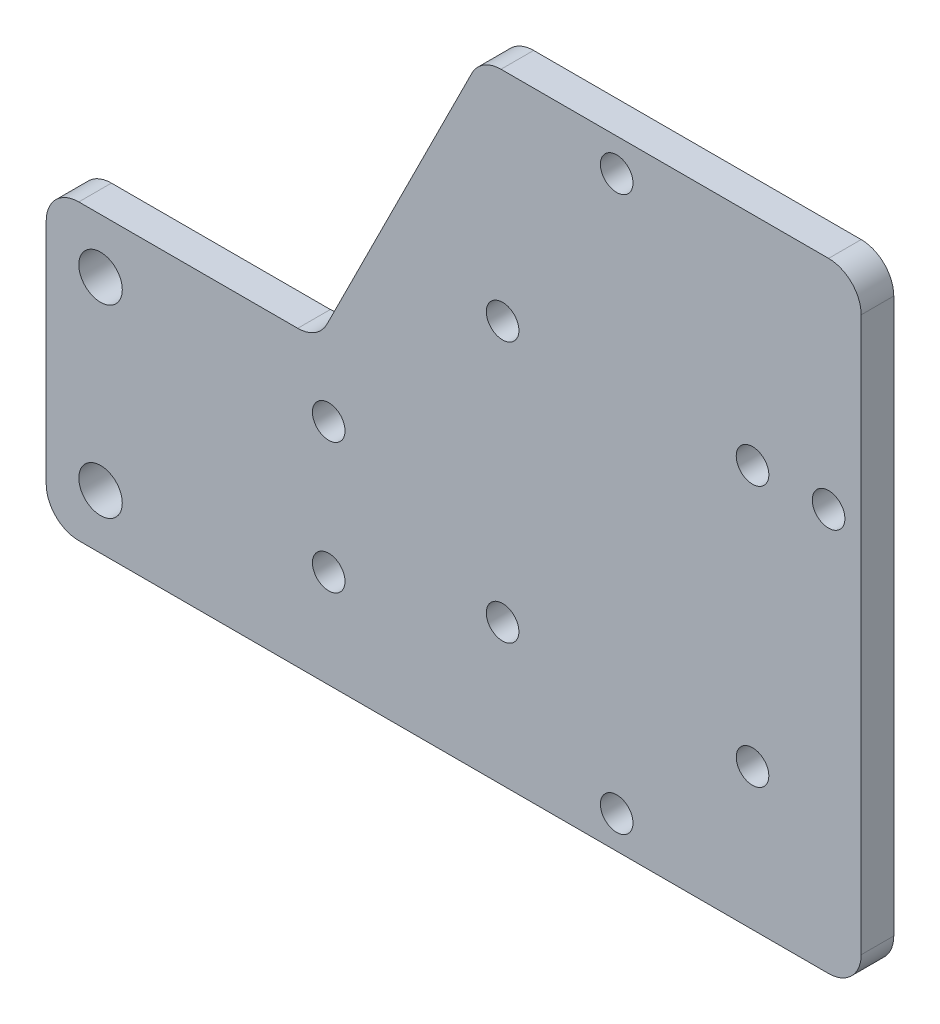
from build123d import *

# Parameters (mm, degrees)
BOSS_EXTRU_1_DEPTH      = 3
ESQUISSE2_R             = 1.5
ENL_V_MAT_EXTRU_1_DEPTH = 95.249668434
ESQUISSE3_R             = 2
ESQUISSE3_R_2           = 1.5
ENL_V_MAT_EXTRU_2_DEPTH = 95.249668434
CONG_1_R                = 3
ESQUISSE4_R             = 1.5
ENL_V_MAT_EXTRU_3_DEPTH = 95.249668434


with BuildPart() as part:
    # Esquisse1 → Boss.-Extru.1 (new body)
    with BuildSketch(Plane.XY):
        Polygon((0, 0), (75, 0), (75, 57), (40, 57), (25, 27), (0, 27), align=None)
    extrude(amount=BOSS_EXTRU_1_DEPTH)

    # Esquisse2 → Enlèv. mat.-Extru.1 (cut, through all)
    with BuildSketch(Plane.XY.offset(3)):
        with Locations((42, 37)):
            Circle(ESQUISSE2_R)
        with Locations(Location((42, 13, 0), (0, 0, 180))):
            Circle(ESQUISSE2_R)
        with Locations((65, 13)):
            Circle(ESQUISSE2_R)
        with Locations(Location((65, 37, 0), (0, 0, 180))):
            Circle(ESQUISSE2_R)
    extrude(amount=-ENL_V_MAT_EXTRU_1_DEPTH, mode=Mode.SUBTRACT)

    # Esquisse3 → Enlèv. mat.-Extru.2 (cut, through all)
    with BuildSketch(Plane.XY.offset(3)):
        with Locations((5, 22)):
            Circle(ESQUISSE3_R)
        with Locations((5, 5)):
            Circle(ESQUISSE3_R)
        with Locations((52.5, 3)):
            Circle(ESQUISSE3_R_2)
        with Locations((52.5, 54)):
            Circle(ESQUISSE3_R_2)
        with Locations((72, 37)):
            Circle(ESQUISSE3_R_2)
    extrude(amount=-ENL_V_MAT_EXTRU_2_DEPTH, mode=Mode.SUBTRACT)

    # Congé1
    cong_1_edges = [part.edges().sort_by_distance(p)[0] for p in [
        (0, 27, 1.5),
        (25, 27, 1.5),
        (40, 57, 1.5),
        (75, 57, 1.5),
        (75, 0, 1.5),
        (0, 0, 1.5),
    ]]
    fillet(cong_1_edges, radius=CONG_1_R)

    # Esquisse4 → Enlèv. mat.-Extru.3 (cut, through all)
    with BuildSketch(Plane.XY.offset(3)):
        with Locations((26, 21)):
            Circle(ESQUISSE4_R)
        with Locations((26, 9)):
            Circle(ESQUISSE4_R)
    extrude(amount=-ENL_V_MAT_EXTRU_3_DEPTH, mode=Mode.SUBTRACT)


solid = part.part
